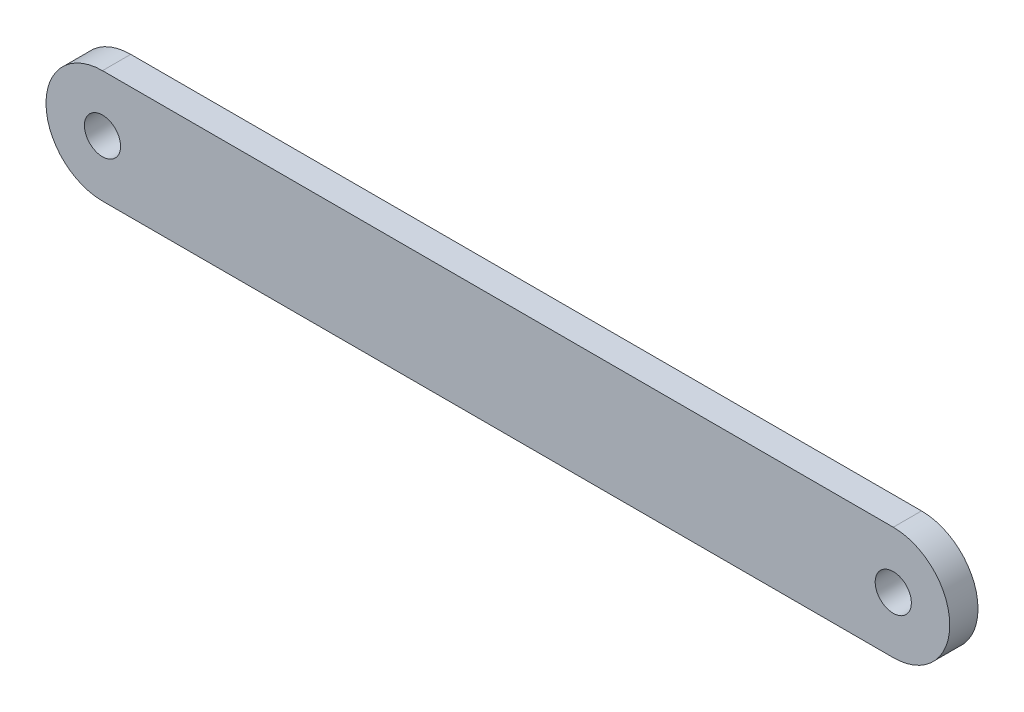
from build123d import *

# Parameters (mm, degrees)
SKETCH1_R           = 2.032
BOSS_EXTRUDE1_DEPTH = 3.175


with BuildPart() as part:
    # Sketch1 → Boss-Extrude1 (new body)
    with BuildSketch(Plane.XY):
        with BuildLine():
            Line((0, -6.35), (-88.9, -6.35))
            ThreePointArc((-88.9, -6.35), (-95.25, 0), (-88.9, 6.35))
            Line((-88.9, 6.35), (0, 6.35))
            ThreePointArc((0, 6.35), (6.35, 0), (0, -6.35))
        make_face()
        Circle(SKETCH1_R, mode=Mode.SUBTRACT)
        with Locations((-88.9, 0)):
            Circle(SKETCH1_R, mode=Mode.SUBTRACT)
    extrude(amount=BOSS_EXTRUDE1_DEPTH)


solid = part.part
